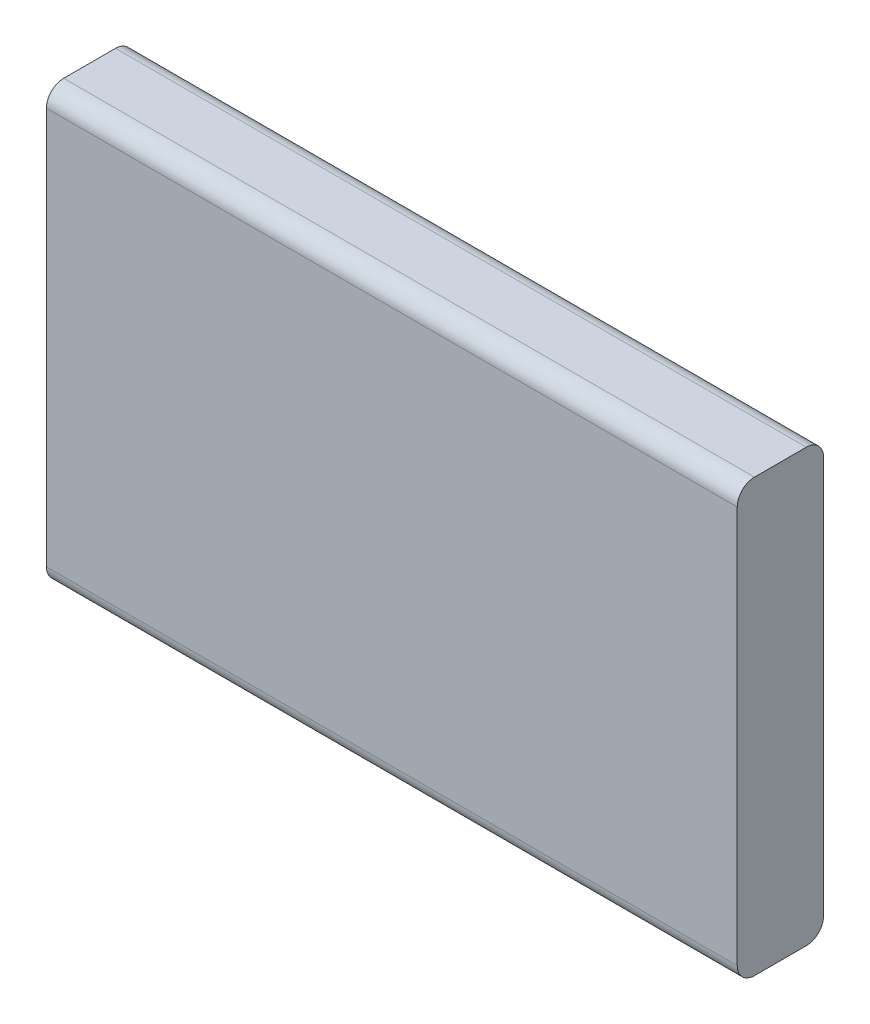
from build123d import *

# Parameters (mm, degrees)
SKETCH_1_W      = 40
SKETCH_1_H      = 25
EXTRUDE_1_DEPTH = 5
FILLET_2_R      = 1
FILLET_3_R      = 1


with BuildPart() as part:
    # 草图1 → 凸台-拉伸1 (new body)
    with BuildSketch(Plane.XY):
        Rectangle(SKETCH_1_W, SKETCH_1_H)
    extrude(amount=-EXTRUDE_1_DEPTH)

    # 圆角2
    fillet_2_edges = [part.edges().sort_by_distance(p)[0] for p in [
        (0, 12.5, 0),
    ]]
    fillet(fillet_2_edges, radius=FILLET_2_R)

    # 圆角3
    fillet_3_edges = [part.edges().sort_by_distance(p)[0] for p in [
        (0, 12.5, -5),
        (0, -12.5, 0),
        (0, -12.5, -5),
    ]]
    fillet(fillet_3_edges, radius=FILLET_3_R)


solid = part.part
